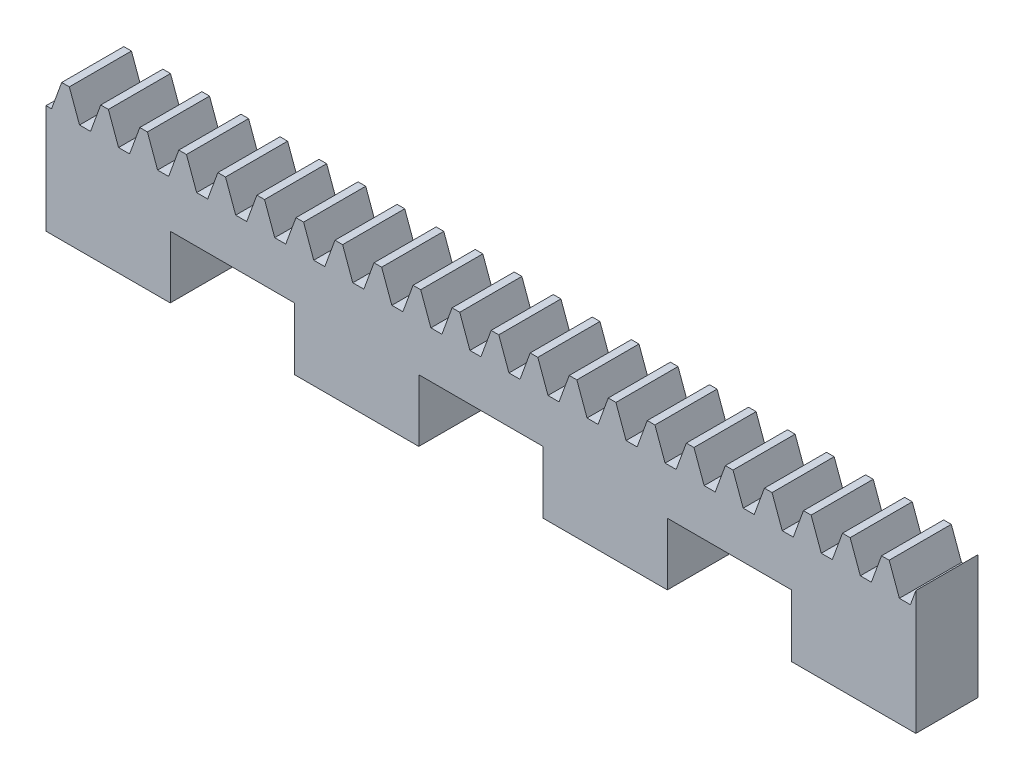
from build123d import *

# Parameters (mm, degrees)
BLANKSKE_W          = 70
BLANKSKE_H          = 11
BLANK_DEPTH         = 5
TOOTHCUTSIM_DEPTH   = 72.035202541
TEETHCUTS_COUNT     = 23
TEETHCUTS_PITCH     = 3.14159265
SKETCH_1_W          = 10
SKETCH_1_H          = 5
CUT_EXTRUDE_1_DEPTH = 72.035202541


with BuildPart() as part:
    # BlankSke → Blank (new body)
    with BuildSketch(Plane.XY):
        with Locations((35, 5.5)):
            Rectangle(BLANKSKE_W, BLANKSKE_H)
    extrude(amount=-BLANK_DEPTH)

    # TooCutSkeSim → ToothCutSim (cut, through all)
    with BuildSketch(Plane.XY):
        Polygon((0.44443537, 8.75), (-0.44443537, 8.75), (-1.272613241, 11.0254), (1.272613241, 11.0254), align=None)
    toothcutsim = extrude(amount=-TOOTHCUTSIM_DEPTH, mode=Mode.SUBTRACT)

    # TeethCuts: ToothCutSim ×23
    with Locations(*[(i * TEETHCUTS_PITCH, 0, 0) for i in range(1, TEETHCUTS_COUNT)]):
        add(toothcutsim, mode=Mode.SUBTRACT)

    # ｽｹｯﾁ1 → ｶｯﾄ - 押し出し1 (cut, through all)
    with BuildSketch(Plane.XY):
        with Locations((15, 2.5)):
            Rectangle(SKETCH_1_W, SKETCH_1_H)
        with Locations((35, 2.5)):
            Rectangle(SKETCH_1_W, SKETCH_1_H)
        with Locations((55, 2.5)):
            Rectangle(SKETCH_1_W, SKETCH_1_H)
    extrude(amount=-CUT_EXTRUDE_1_DEPTH, mode=Mode.SUBTRACT)


solid = part.part
